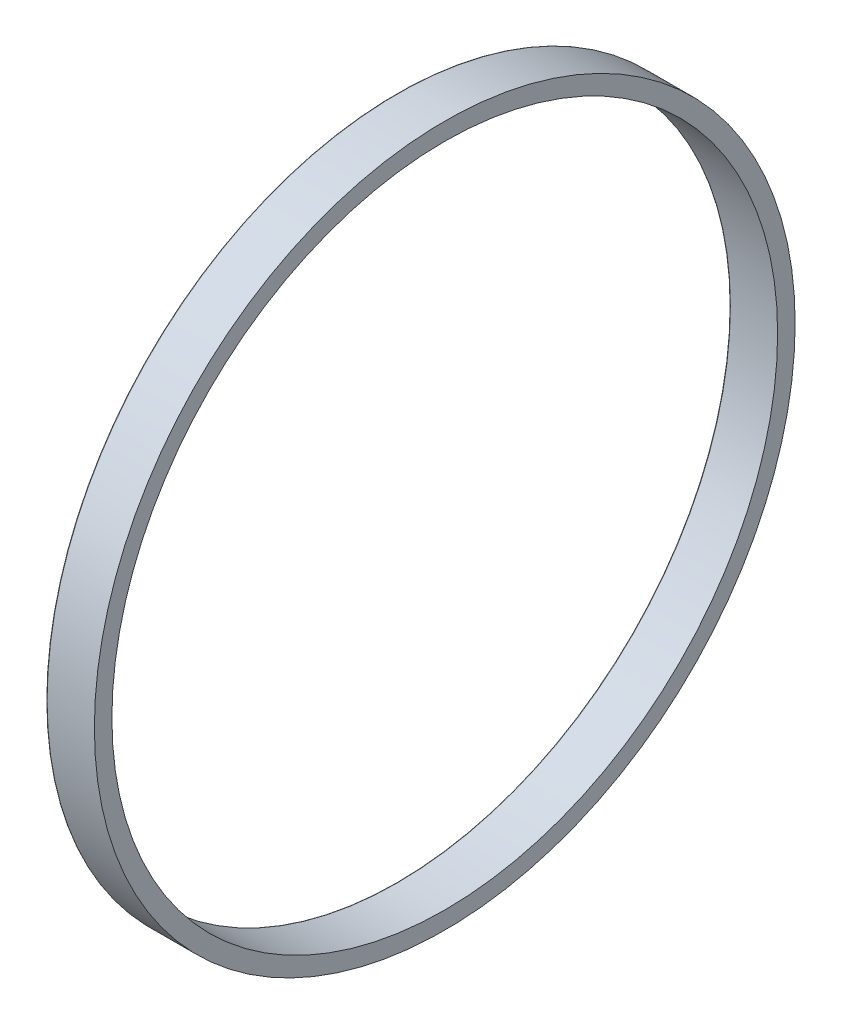
from build123d import *


with BuildPart() as part:
    # Sketch1 → Revolve1 (revolve)
    with BuildSketch(Plane.XY, mode=Mode.PRIVATE) as revolve1_sk:
        with BuildLine():
            Line((-37.809513487, -40), (-32.425741253, -40))
            Line((-32.425741253, -40), (-32.425741253, -38))
            Line((-32.425741253, -38), (-37.809513487, -38))
            ThreePointArc((-37.809513487, -38), (-37.908222233, -38.083981776), (-37.841136263, -38.19486833))
            Line((-37.841136263, -38.19486833), (-35.994951232, -38.81026334))
            ThreePointArc((-35.994951232, -38.81026334), (-35.858196785, -39), (-35.994951232, -39.18973666))
            Line((-35.994951232, -39.18973666), (-37.841136263, -39.80513167))
            ThreePointArc((-37.841136263, -39.80513167), (-37.908222233, -39.916018224), (-37.809513487, -40))
        make_face()
    revolve(revolve1_sk.sketch.rotate(Axis((-83.208746897, 0, 0), (1, 0, 0)), 270), axis=Axis((-83.208746897, 0, 0), (1, 0, 0)))


solid = part.part
